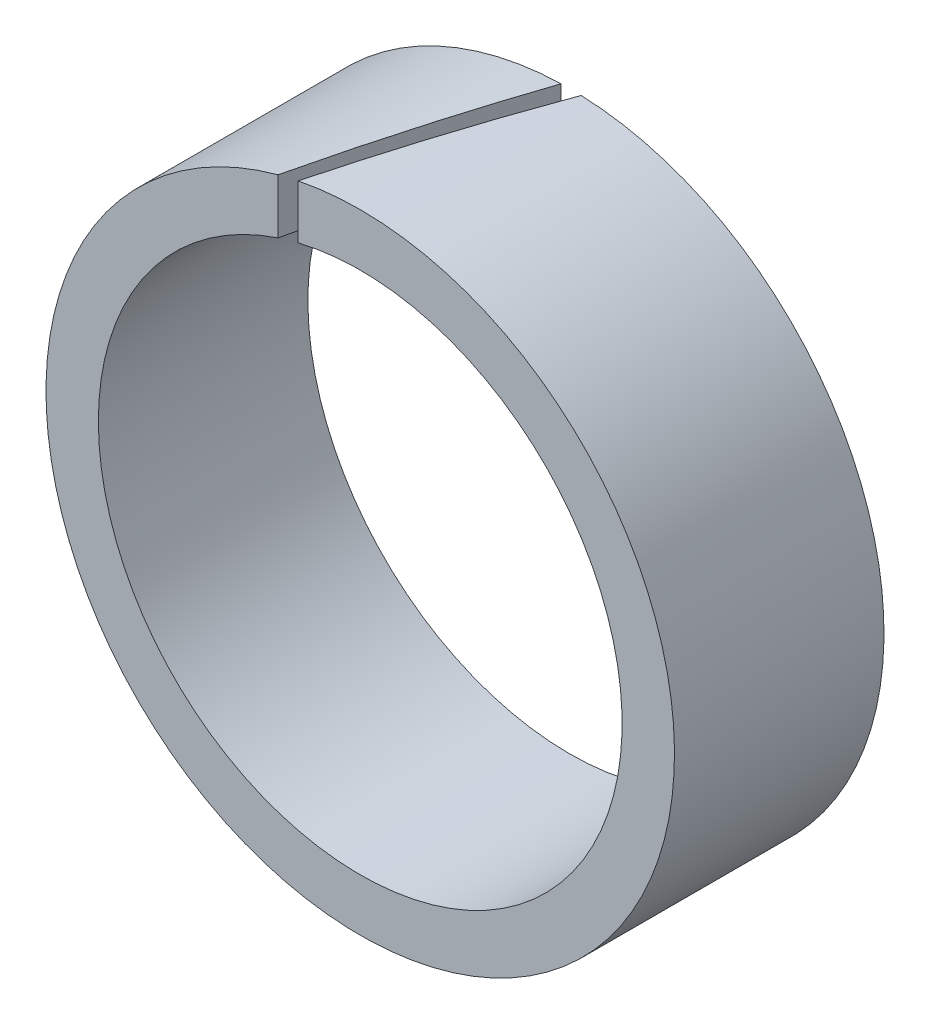
from build123d import *

# Parameters (mm, degrees)
SKETCH1_R           = 15
SKETCH1_R_2         = 12.5
BOSS_EXTRUDE1_DEPTH = 10
CUT_EXTRUDE1_DEPTH  = 10


with BuildPart() as part:
    # Sketch1 → Boss-Extrude1 (new body)
    with BuildSketch(Plane.XY):
        Circle(SKETCH1_R)
        Circle(SKETCH1_R_2, mode=Mode.SUBTRACT)
    extrude(amount=BOSS_EXTRUDE1_DEPTH)

    # Sketch2 → Cut-Extrude1 (cut)
    with BuildSketch(Plane(origin=(0, 15, 0), x_dir=(1, 0, 0), z_dir=(0, 1, 0))):
        Polygon((0.693116527, 3.154438347), (-4.706995906, -12.228203461), (-3.793236096, -12.355616729), (1.606876337, 3.02702508), align=None)
    extrude(amount=-CUT_EXTRUDE1_DEPTH, mode=Mode.SUBTRACT)


solid = part.part
